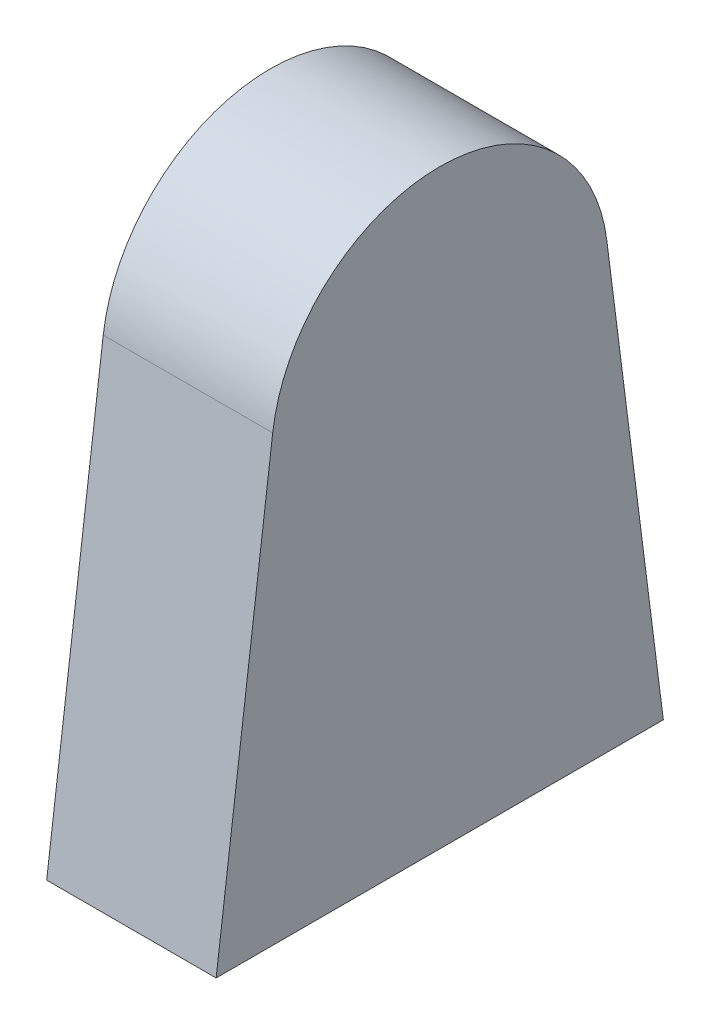
from build123d import *

# Parameters (mm, degrees)
BOSS_EXTRUDE1_DEPTH = 1
BOSS_EXTRUDE2_START = 0.5
BOSS_EXTRUDE2_DEPTH = 0.5
BOSS_EXTRUDE6_DEPTH = 0.5


with BuildPart() as part:
    # Sketch1 → Boss-Extrude1 (new, symmetric)
    with BuildSketch(Plane(origin=(0, 0, 0), x_dir=(0, 0, -1), z_dir=(1, 0, 0))):
        with BuildLine():
            Line((2.95, 0), (1.965, 7.729516129))
            ThreePointArc((1.965, 7.729516129), (0, 9.46), (-1.965, 7.729516129))
            Line((-1.965, 7.729516129), (-2.95, 0))
            Line((-2.95, 0), (-3.958086961, 0))
            Line((-3.958086961, 0), (-2.956977914, 7.855927438))
            ThreePointArc((-2.956977914, 7.855927438), (0, 10.46), (2.956977914, 7.855927438))
            Line((2.956977914, 7.855927438), (3.958086961, 0))
            Line((3.958086961, 0), (2.95, 0))
        make_face()
    extrude(amount=BOSS_EXTRUDE1_DEPTH, both=True)

    # Sketch2 → Boss-Extrude2 (add)
    with BuildSketch(Plane(origin=(1, 0, 0), x_dir=(0, 0, -1), z_dir=(1, 0, 0)).offset(BOSS_EXTRUDE2_START)):
        with BuildLine():
            Line((2.95, 0), (3.958086961, 0))
            Line((3.958086961, 0), (2.956977914, 7.855927438))
            ThreePointArc((2.956977914, 7.855927438), (0, 10.46), (-2.956977914, 7.855927438))
            Line((-2.956977914, 7.855927438), (-3.958086961, 0))
            Line((-3.958086961, 0), (-2.95, 0))
            Line((-2.95, 0), (2.95, 0))
        make_face()
    extrude(amount=-BOSS_EXTRUDE2_DEPTH)

    # Sketch3 → Boss-Extrude6 (add)
    with BuildSketch(Plane.ZY.offset(1)):
        with BuildLine():
            Line((-3.958086961, 0), (3.958086961, 0))
            Line((3.958086961, 0), (2.956977914, 7.855927438))
            ThreePointArc((2.956977914, 7.855927438), (0, 10.46), (-2.956977914, 7.855927438))
            Line((-2.956977914, 7.855927438), (-3.958086961, 0))
        make_face()
    extrude(amount=BOSS_EXTRUDE6_DEPTH)


solid = part.part
